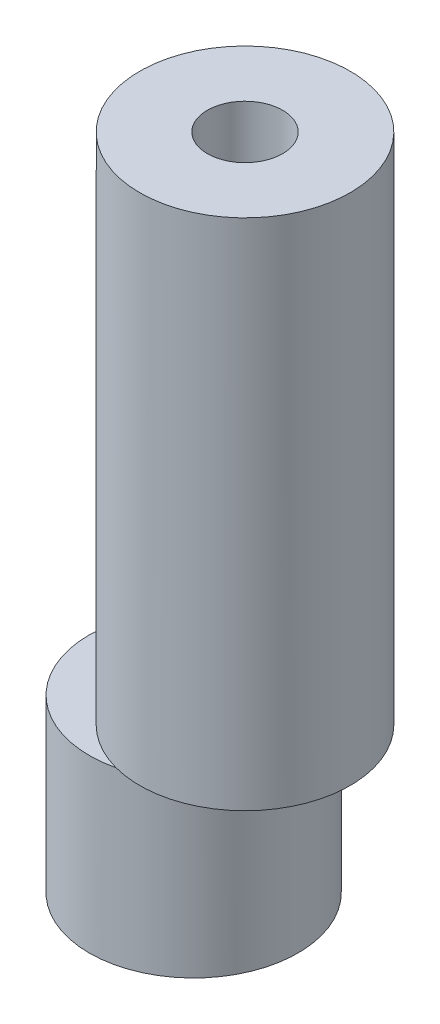
from build123d import *

# Parameters (mm, degrees)
SKETCH1_R           = 3.05
BOSS_EXTRUDE1_DEPTH = 5
SKETCH2_R           = 3.075
SKETCH2_R_2         = 1.1
BOSS_EXTRUDE2_DEPTH = 15


with BuildPart() as part:
    # Sketch1 → Boss-Extrude1 (new body)
    with BuildSketch(Plane(origin=(0, 0, 0), x_dir=(1, 0, 0), z_dir=(0, 1, 0))):
        with Locations(Location((0, 0, 0), (0, 0, 270))):
            Circle(SKETCH1_R)
    extrude(amount=BOSS_EXTRUDE1_DEPTH)

    # Sketch2 → Boss-Extrude2 (add)
    with BuildSketch(Plane(origin=(0, 5, 0), x_dir=(1, 0, 0), z_dir=(0, 1, 0))):
        with Locations(Location((1.5, 0, 0), (0, 0, 105.099812849))):
            Circle(SKETCH2_R)
        with Locations(Location((1.5, 0, 0), (0, 0, 270))):
            Circle(SKETCH2_R_2, mode=Mode.SUBTRACT)
    extrude(amount=BOSS_EXTRUDE2_DEPTH)


solid = part.part
